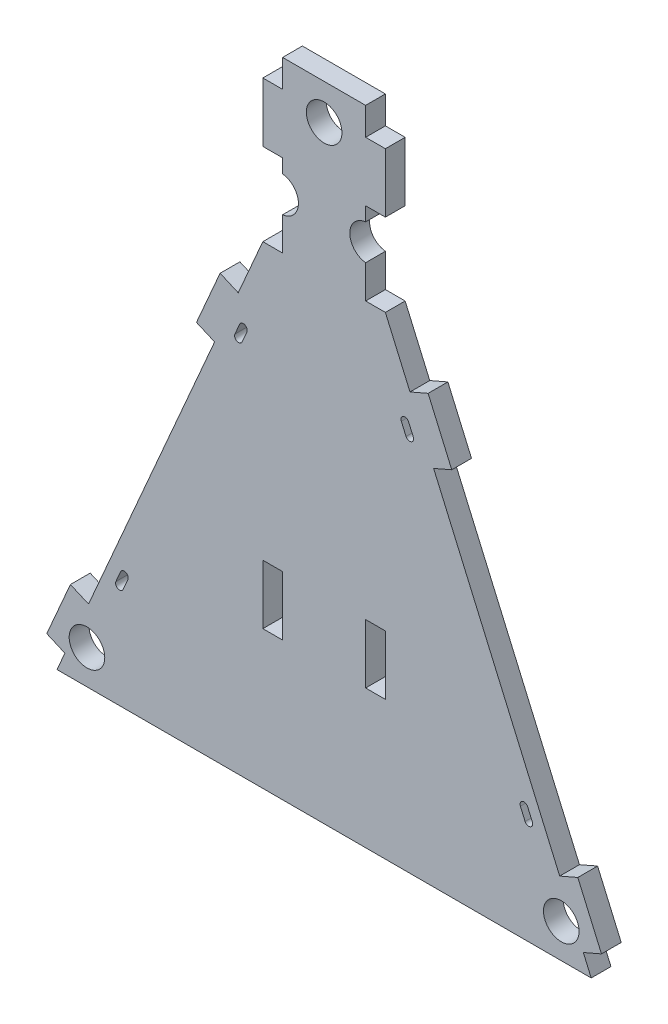
from build123d import *

# Parameters (mm, degrees)
BOSS_EXTRUDE1_DEPTH = 5
SKETCH3_W           = 5
SKETCH3_H           = 15
BOSS_EXTRUDE2_DEPTH = 5
SKETCH4_R           = 4.5
CUT_EXTRUDE1_DEPTH  = 178.20653008
SKETCH5_W           = 5
SKETCH5_H           = 15
CUT_EXTRUDE2_DEPTH  = 178.20653008
CUT_EXTRUDE3_DEPTH  = 178.20653008


with BuildPart() as part:
    # Sketch1 → Boss-Extrude1 (new body)
    with BuildSketch(Plane.XY):
        with BuildLine():
            Line((0, 0), (67.568382456, 0))
            Line((67.568382456, 0), (15.5, 119.786515986))
            Line((15.5, 119.786515986), (10.5, 119.786515986))
            Line((10.5, 119.786515986), (10.5, 128.17540896))
            ThreePointArc((10.5, 128.17540896), (6.5, 132.647544915), (10.5, 137.11968087))
            Line((10.5, 137.11968087), (10.5, 162.648799484))
            Line((10.5, 162.648799484), (0, 162.648799484))
            Line((0, 162.648799484), (0, 0))
        make_face()
    boss_extrude1 = extrude(amount=BOSS_EXTRUDE1_DEPTH)

    # Sketch3 → Boss-Extrude2 (add)
    with BuildSketch(Plane.XY.offset(5)):
        Polygon((65.57516115, 4.585528195), (59.595497232, 18.34211278), (64.181025427, 20.335334085), (70.160689345, 6.578749501), align=None)
        Polygon((27.703956339, 91.710563898), (21.724292422, 105.467148482), (26.309820617, 107.460369788), (32.289484534, 93.703785203), align=None)
        with Locations((13, 148.148799484)):
            Rectangle(SKETCH3_W, SKETCH3_H)
    boss_extrude2 = extrude(amount=-BOSS_EXTRUDE2_DEPTH)

    # Mirror1: Boss-Extrude1, Boss-Extrude2 across plane
    add(boss_extrude1.mirror(Plane(origin=(0, 162.648799484, 5), x_dir=(0, 0, 1), z_dir=(1, 0, 0))))
    add(boss_extrude2.mirror(Plane(origin=(0, 162.648799484, 5), x_dir=(0, 0, 1), z_dir=(1, 0, 0))))

    # Sketch4 → Cut-Extrude1 (cut, through all)
    with BuildSketch(Plane.XY.offset(5)):
        with Locations((0, 153.648852717)):
            Circle(SKETCH4_R)
        with Locations((-59.99258678, 8.648878597)):
            Circle(SKETCH4_R)
        with Locations((59.99258678, 8.648878597)):
            Circle(SKETCH4_R)
    extrude(amount=-CUT_EXTRUDE1_DEPTH, mode=Mode.SUBTRACT)

    # Sketch5 → Cut-Extrude2 (cut, through all)
    with BuildSketch(Plane.XY.offset(5)):
        with Locations((13, 42.5)):
            Rectangle(SKETCH5_W, SKETCH5_H)
        with Locations((-13, 42.5)):
            Rectangle(SKETCH5_W, SKETCH5_H)
    extrude(amount=-CUT_EXTRUDE2_DEPTH, mode=Mode.SUBTRACT)

    # Sketch6 → Cut-Extrude3 (cut, through all)
    with BuildSketch(Plane.XY.offset(5)):
        with BuildLine():
            Line((-52.677576554, 26.731708191), (-51.481643771, 29.483025108))
            ThreePointArc((-51.481643771, 29.483025108), (-50.16589387, 30.001486486), (-49.647432493, 28.685736586))
            Line((-49.647432493, 28.685736586), (-50.843365276, 25.934419669))
            ThreePointArc((-50.843365276, 25.934419669), (-52.159115176, 25.415958291), (-52.677576554, 26.731708191))
        make_face()
        with BuildLine():
            Line((-22.560773856, 96.017264948), (-21.364841072, 98.768581865))
            ThreePointArc((-21.364841072, 98.768581865), (-20.049091172, 99.287043243), (-19.530629794, 97.971293343))
            Line((-19.530629794, 97.971293343), (-20.726562578, 95.219976426))
            ThreePointArc((-20.726562578, 95.219976426), (-22.042312478, 94.701515048), (-22.560773856, 96.017264948))
        make_face()
    cut_extrude3 = extrude(amount=-CUT_EXTRUDE3_DEPTH, mode=Mode.SUBTRACT)

    # Mirror2: Cut-Extrude3 across plane
    add(cut_extrude3.mirror(Plane(origin=(0, 0, 0), x_dir=(0, 0, 1), z_dir=(1, 0, 0))), mode=Mode.SUBTRACT)


solid = part.part
